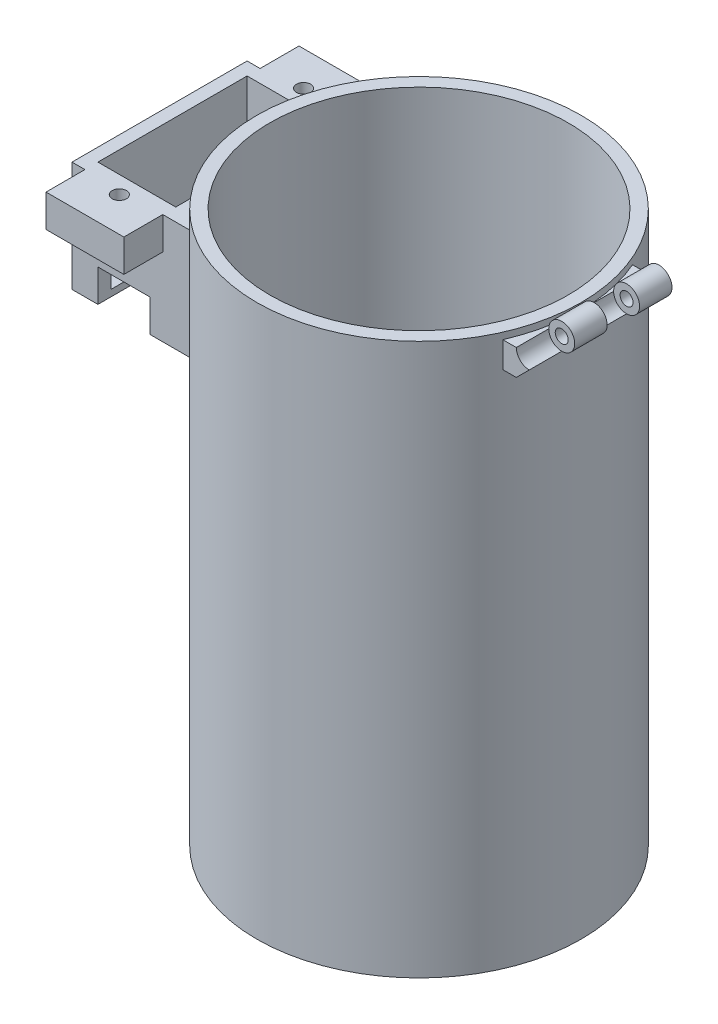
from build123d import *

# Parameters (mm, degrees)
SKETCH1_R                            = 25
BOSS_EXTRUDE1_DEPTH                  = 85
SHELL1_T                             = -2
SKETCH2_R                            = 3.5
CUT_EXTRUDE1_DEPTH                   = 2
BOSS_EXTRUDE4_DEPTH                  = 10
BOSS_EXTRUDE4_DEPTH_BACK             = 10
BOSS_EXTRUDE6_REACH                  = 104.572
SKETCH8_W                            = 20
SKETCH8_H                            = 4
CUT_EXTRUDE4_DEPTH                   = 98.272812234
CUT_EXTRUDE4_DEPTH_BACK              = 98.272812234
SKETCH9_R                            = 1
CUT_EXTRUDE5_START                   = -5
SKETCH10_R                           = 2
CUT_EXTRUDE5_DEPTH                   = 5
LPATTERN2_COUNT                      = 2
LPATTERN2_PITCH                      = 10
SKETCH11_W                           = 27
SKETCH11_H                           = 17
BOSS_EXTRUDE7_DEPTH                  = 15
BOSS_EXTRUDE7_DIRECTION_2_REACH      = 106.58
BOSS_EXTRUDE7_DIRECTION_2_END_RADIUS = 25
SKETCH12_W                           = 12
SKETCH12_H                           = 23
CUT_EXTRUDE6_DEPTH                   = 16
SKETCH13_W                           = 12
SKETCH13_H                           = 5
BOSS_EXTRUDE8_DEPTH                  = 6
SKETCH14_R                           = 1.1
CUT_EXTRUDE7_DEPTH                   = 5
CUT_EXTRUDE8_REACH                   = 104.363
SKETCH15_W                           = 8
SKETCH15_H                           = 5
SKETCH16_R                           = 3
CUT_EXTRUDE9_DEPTH                   = 2


with BuildPart() as part:
    # Sketch1 → Boss-Extrude1 (new body)
    with BuildSketch(Plane(origin=(0, 0, 0), x_dir=(1, 0, 0), z_dir=(0, 1, 0))):
        with Locations(Location((0, 0, 0), (0, 0, 270))):
            Circle(SKETCH1_R)
    extrude(amount=BOSS_EXTRUDE1_DEPTH)

    # Shell1
    shell1_openings = [part.faces().sort_by_distance(p)[0] for p in [
        (0, 85, 0),
    ]]
    offset(amount=SHELL1_T, openings=shell1_openings, kind=Kind.INTERSECTION)

    # Sketch2 → Cut-Extrude1 (cut)
    with BuildSketch(Plane(origin=(0, 2, 0), x_dir=(1, 0, 0), z_dir=(0, 1, 0))):
        with Locations(Location((15, 0, 0), (0, 0, 270))):
            Circle(SKETCH2_R)
        with Locations(Location((7.5, -12.990381057, 0), (0, 0, 270))):
            Circle(SKETCH2_R)
        with Locations(Location((-7.5, -12.990381057, 0), (0, 0, 270))):
            Circle(SKETCH2_R)
        with Locations(Location((-15, 0, 0), (0, 0, 270))):
            Circle(SKETCH2_R)
        with Locations(Location((-7.5, 12.990381057, 0), (0, 0, 270))):
            Circle(SKETCH2_R)
        with Locations(Location((7.5, 12.990381057, 0), (0, 0, 270))):
            Circle(SKETCH2_R)
    extrude(amount=-CUT_EXTRUDE1_DEPTH, mode=Mode.SUBTRACT)

    # Sketch8 → Boss-Extrude6 (add, up to next)
    with BuildSketch(Plane.ZY.offset(-25), mode=Mode.PRIVATE) as boss_extrude6_sk1:
        with Locations((0, 82)):
            Rectangle(SKETCH8_W, SKETCH8_H)
    boss_extrude6_tool1 = extrude(boss_extrude6_sk1.sketch, amount=BOSS_EXTRUDE6_REACH, mode=Mode.PRIVATE) - part.part


with BuildPart() as body_2:
    # Sketch3 → Boss-Extrude4 (new, two sides: drawn at the far end of the back side and taken through both)
    with BuildSketch(Plane.XY.offset(-BOSS_EXTRUDE4_DEPTH_BACK)):
        with BuildLine():
            Line((25, 84), (25, 80))
            Line((25, 80), (27, 82))
            ThreePointArc((27, 82), (28.414213562, 85.414213562), (25, 84))
        make_face()
    extrude(amount=BOSS_EXTRUDE4_DEPTH + BOSS_EXTRUDE4_DEPTH_BACK)


with BuildPart() as part_1:
    add(part.part)

    add(body_2.part)  # Boss-Extrude6 merges body 2
    add(boss_extrude6_tool1.solids().sort_by_distance((25, 82, 0))[0])
    add(boss_extrude6_tool1.solids().sort_by_distance((25, 82, 0))[1])

    # Sketch9 → Cut-Extrude4 (cut, two sides: drawn at the far end of the back side and taken through both)
    with BuildSketch(Plane.XY.offset(10).offset(-CUT_EXTRUDE4_DEPTH_BACK)):
        with Locations((27, 84)):
            Circle(SKETCH9_R)
    extrude(amount=CUT_EXTRUDE4_DEPTH + CUT_EXTRUDE4_DEPTH_BACK, mode=Mode.SUBTRACT)

    # Sketch10 → Cut-Extrude5 (cut)
    with BuildSketch(Plane.XY.offset(10).offset(CUT_EXTRUDE5_START)):
        with Locations((27, 84)):
            Circle(SKETCH10_R)
    cut_extrude5 = extrude(amount=CUT_EXTRUDE5_DEPTH, mode=Mode.SUBTRACT)

    # LPattern2: Cut-Extrude5 ×2
    with Locations(*[(0, 0, -i * LPATTERN2_PITCH) for i in range(1, LPATTERN2_COUNT)]):
        add(cut_extrude5, mode=Mode.SUBTRACT)

    # Sketch16 → Cut-Extrude9 (cut)
    with BuildSketch(Plane(origin=(0, 2, 0), x_dir=(1, 0, 0), z_dir=(0, 1, 0))):
        with Locations(Location((0, 0, 0), (0, 0, 270))):
            Circle(SKETCH16_R)
    extrude(amount=-CUT_EXTRUDE9_DEPTH, mode=Mode.SUBTRACT)


with BuildPart() as body_2_2:
    # Sketch11 → Boss-Extrude7 (new body)
    with BuildSketch(Plane(origin=(-25, 0, 0), x_dir=(0, 0, -1), z_dir=(1, 0, 0))):
        with Locations((0, 69.5)):
            Rectangle(SKETCH11_W, SKETCH11_H)
    extrude(amount=-BOSS_EXTRUDE7_DEPTH)

    # Boss-Extrude7 direction 2: up to this cylinder (the profile starts outside it)
    boss_extrude7_direction_2_end = Plane(origin=(0, 69.5, 0), z_dir=(0, -1, 0)) * Cylinder(BOSS_EXTRUDE7_DIRECTION_2_END_RADIUS, 264.16, mode=Mode.PRIVATE)
    # Sketch11 → Boss-Extrude7 direction 2 (add, up to the surface)
    with BuildSketch(Plane(origin=(-25, 0, 0), x_dir=(0, 0, -1), z_dir=(1, 0, 0)), mode=Mode.PRIVATE) as boss_extrude7_direction_2_sk1:
        with Locations((0, 69.5)):
            Rectangle(SKETCH11_W, SKETCH11_H)
    boss_extrude7_direction_2_tool1 = extrude(boss_extrude7_direction_2_sk1.sketch, amount=BOSS_EXTRUDE7_DIRECTION_2_REACH, mode=Mode.PRIVATE) - boss_extrude7_direction_2_end
    add(boss_extrude7_direction_2_tool1.solids().sort_by_distance((-25, 69.5, 0))[0])
    add(boss_extrude7_direction_2_tool1.solids().sort_by_distance((-25, 69.5, 0))[1])

    # Sketch12 → Cut-Extrude6 (cut)
    with BuildSketch(Plane(origin=(0, 78, 0), x_dir=(1, 0, 0), z_dir=(0, 1, 0))):
        with Locations((-32, 0)):
            Rectangle(SKETCH12_W, SKETCH12_H)
    extrude(amount=-CUT_EXTRUDE6_DEPTH, mode=Mode.SUBTRACT)

    # Sketch13 → Boss-Extrude8 (add)
    with BuildSketch(Plane.XY.offset(13.5)):
        with Locations((-32, 75.5)):
            Rectangle(SKETCH13_W, SKETCH13_H)
    boss_extrude8 = extrude(amount=BOSS_EXTRUDE8_DEPTH)

    # Sketch14 → Cut-Extrude7 (cut)
    with BuildSketch(Plane(origin=(0, 78, 0), x_dir=(1, 0, 0), z_dir=(0, 1, 0))):
        with Locations(Location((-32, -14.2, 0), (0, 0, 270))):
            Circle(SKETCH14_R)
    cut_extrude7 = extrude(amount=-CUT_EXTRUDE7_DEPTH, mode=Mode.SUBTRACT)

    # Mirror1: Boss-Extrude8, Cut-Extrude7 across plane
    add(boss_extrude8.mirror(Plane.XY))
    add(cut_extrude7.mirror(Plane.XY), mode=Mode.SUBTRACT)

    # Cut-Extrude8: up to this face of the body (flat: up to its plane)
    cut_extrude8_end = Plane(body_2_2.part.faces().sort_by_distance((-30.182445112, 68.127485799, 13.5))[0])
    # Sketch15 → Cut-Extrude8 (cut, up to the picked face)
    with BuildSketch(Plane(origin=(0, 0, -13.5), x_dir=(-1, 0, 0), z_dir=(0, 0, -1)), mode=Mode.PRIVATE) as cut_extrude8_sk1:
        with Locations((32, 63.5)):
            Rectangle(SKETCH15_W, SKETCH15_H)
    cut_extrude8_tool1 = split(extrude(cut_extrude8_sk1.sketch, amount=-CUT_EXTRUDE8_REACH, mode=Mode.PRIVATE), bisect_by=cut_extrude8_end, keep=Keep.BOTH, mode=Mode.PRIVATE)
    add(cut_extrude8_tool1.solids().sort_by(Axis((-32, 63.5, -13.5), (0, 0, 1)))[0], mode=Mode.SUBTRACT)


solid = Compound([part_1.part, body_2_2.part])
